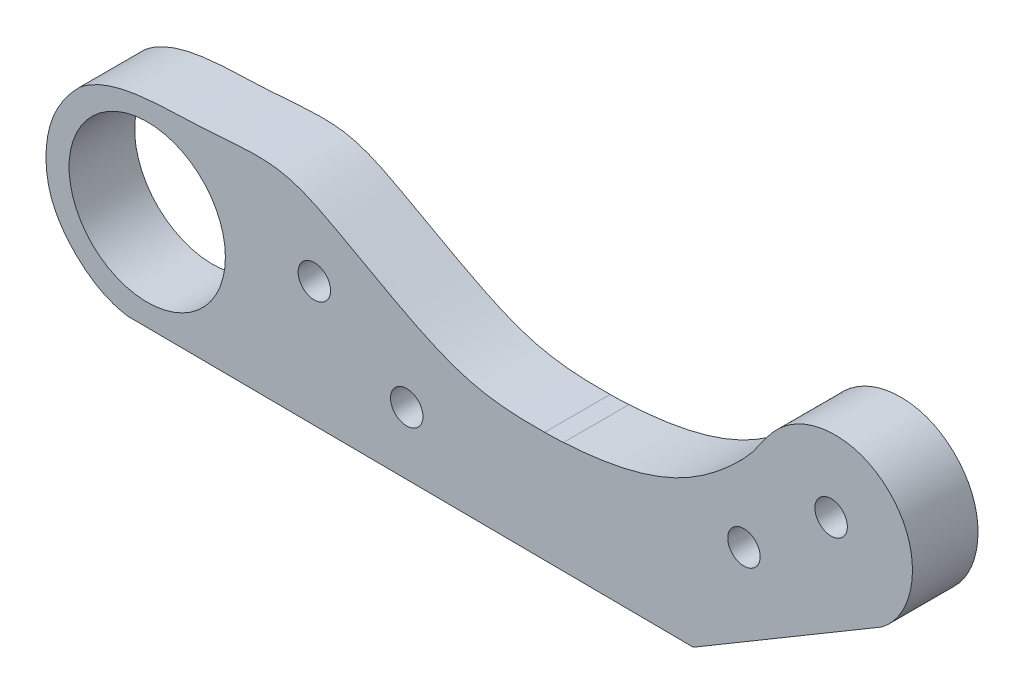
from build123d import *

# Parameters (mm, degrees)
SCHIZZO2_R                   = 6.02
SCHIZZO2_R_2                 = 1.7
ESTRUSIONE_ESTRUSIONE1_DEPTH = 5.05
FORO_FILETTATO_M3X0_5_1_D    = 2.5


with BuildPart() as part:
    # Schizzo2 → Estrusione-Estrusione1 (new body)
    # profile 1 of 3: a face of its own
    with BuildSketch(Plane.XY):
        with BuildLine():
            Line((-89.374898214, 10.44391596), (-45.806517375, 10.138527109))
            Line((-45.806517375, 10.138527109), (-31.279343931, 18.753125585))
            add(Edge.make_bspline(
                [(-31.279343931, 18.753125585), (-29.098043345, 20.403651058), (-27.905057256, 25.441624833), (-32.300384053, 29.85841163), (-36.690541673, 29.918863446), (-39.614892883, 27.942376602), (-41.03245157, 25.552100431), (-43.284640457, 23.241638673), (-47.763557065, 19.862154048), (-52.57074608, 18.979169365), (-55.803154975, 18.8049533)],
                knots=[0, 0, 0, 0, 0.102244465, 0.160154236, 0.214292787, 0.256272844, 0.289149591, 0.319658417, 0.379342086, 0.500706378, 0.500706378, 0.500706378, 0.500706378], degree=3))
            add(Edge.make_bspline(
                [(-57.25626525, 18.753125585), (-56.52869344, 18.753125585), (-55.803154975, 18.8049533)],
                knots=[4.71238898, 4.71238898, 4.71238898, 4.787168695, 4.787168695, 4.787168695], degree=2, weights=[1, 0.999301081, 1]))
            add(Edge.make_bspline(
                [(-57.25626525, 18.753125585), (-59.155150134, 18.717879159), (-63.127762505, 18.895973961), (-68.30110331, 21.45743798), (-72.985617709, 24.08656858), (-76.315266746, 25.875128424), (-79.739526403, 26.236715977), (-83.278928702, 25.795001813), (-88.238817678, 25.8484339), (-91.689171987, 24.998953947), (-93.083744843, 23.851210505)],
                knots=[0.518902231, 0.518902231, 0.518902231, 0.518902231, 0.590344576, 0.669858142, 0.735080639, 0.798411316, 0.810363017, 0.866325434, 0.934003559, 1, 1, 1, 1], degree=3))
            add(Edge.make_bspline(
                [(-93.083744843, 23.851210505), (-93.963586918, 22.989018523), (-95.239548576, 21.18289576), (-95.824246169, 18.047120823), (-95.406173905, 15.162358675), (-93.315245164, 12.148204862), (-91.089335339, 10.692555949), (-89.374898214, 10.44391596)],
                knots=[0.80240839, 0.80240839, 0.80240839, 0.80240839, 0.844688232, 0.876032892, 0.910905343, 0.942275004, 1, 1, 1, 1], degree=3))
        make_face()
        with Locations((-87.866678473, 18.139302594)):
            Circle(SCHIZZO2_R, mode=Mode.SUBTRACT)
        with Locations((-74.993560801, 19.956508848)):
            Circle(SCHIZZO2_R_2, mode=Mode.SUBTRACT)
        with Locations((-35.18906777, 24.113568479)):
            Circle(SCHIZZO2_R_2, mode=Mode.SUBTRACT)
    # profile 2 of 3: a face of its own
    with BuildSketch(Plane.XY):
        with Locations((-74.993560801, 19.956508848)):
            Circle(SCHIZZO2_R_2)
    # profile 3 of 3: a face of its own
    with BuildSketch(Plane.XY):
        with Locations((-35.18906777, 24.113568479)):
            Circle(SCHIZZO2_R_2)
    extrude(amount=ESTRUSIONE_ESTRUSIONE1_DEPTH)

    # Foro filettato M3x0.5-1 (through all)
    with Locations(Plane.XY.offset(5.05)):
        with Locations((-67.876621075, 15.110612874), (-74.993560801, 19.956508848), (-41.903191958, 18.753125585), (-35.18906777, 24.113568479)):
            Hole(FORO_FILETTATO_M3X0_5_1_D / 2)


solid = part.part
